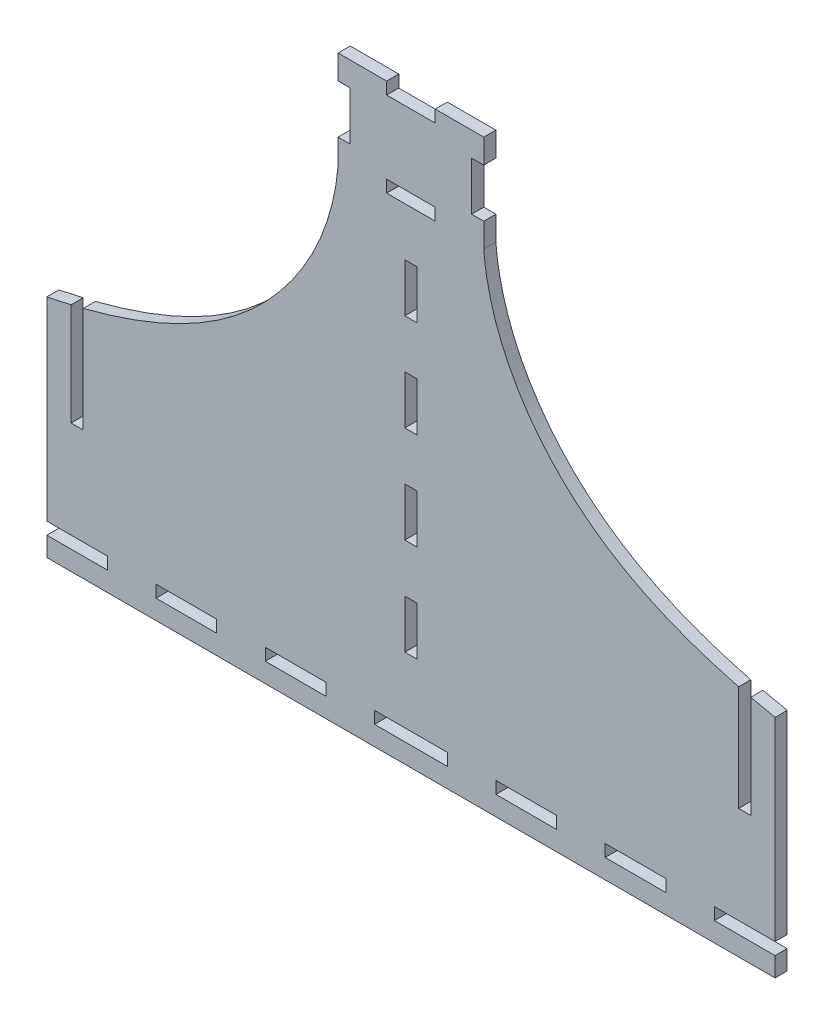
from build123d import *

# Parameters (mm, degrees)
SKETCH1_W           = 20
SKETCH1_H           = 5
SKETCH1_W_2         = 5
SKETCH1_H_2         = 20
SKETCH1_W_3         = 25
SKETCH1_W_4         = 30
BOSS_EXTRUDE1_DEPTH = 5


with BuildPart() as part:
    # Sketch1 → Boss-Extrude1 (new body)
    with BuildSketch(Plane.XY):
        with BuildLine():
            Line((-39.784412909, 125.453201578), (-39.784412909, 135.453201578))
            Line((-39.784412909, 135.453201578), (-44.784412909, 135.453201578))
            Line((-44.784412909, 135.453201578), (-44.784412909, 155.453201578))
            Line((-44.784412909, 155.453201578), (-39.784412909, 155.453201578))
            Line((-39.784412909, 155.453201578), (-39.784412909, 165.453201578))
            Line((-39.784412909, 165.453201578), (-59.784412909, 165.453201578))
            Line((-59.784412909, 165.453201578), (-59.784412909, 160.453201578))
            Line((-59.784412909, 160.453201578), (-79.784412909, 160.453201578))
            Line((-79.784412909, 160.453201578), (-79.784412909, 165.453201578))
            Line((-79.784412909, 165.453201578), (-99.784412909, 165.453201578))
            Line((-99.784412909, 165.453201578), (-99.784412909, 155.453201578))
            Line((-99.784412909, 155.453201578), (-94.784412909, 155.453201578))
            Line((-94.784412909, 155.453201578), (-94.784412909, 135.453201578))
            Line((-94.784412909, 135.453201578), (-99.784412909, 135.453201578))
            Line((-99.784412909, 135.453201578), (-99.784412909, 125.453201578))
            add(Edge.make_bspline(
                [(-204.784412909, 21.843580993), (-197.506230119, 23.701939803), (-175.474625692, 30.348491442), (-128.147146094, 54.275433129), (-102.183870773, 95.209842597), (-99.784412909, 125.453201578)],
                knots=[0.089716065, 0.089716065, 0.089716065, 0.089716065, 0.220283612, 0.4864068, 1, 1, 1, 1], degree=3))
            Line((-204.784412909, 21.843580993), (-204.784412909, -21.546798422))
            Line((-204.784412909, -21.546798422), (-209.784412909, -21.546798422))
            Line((-209.784412909, -21.546798422), (-209.784412909, 20.618388045))
            add(Edge.make_bspline(
                [(-219.784412909, 18.453201578), (-214.791132261, 19.441715958), (-209.784412909, 20.618388045)],
                knots=[0, 0, 0, 0.0598328, 0.0598328, 0.0598328], degree=2))
            Line((-219.784412909, 18.453201578), (-219.784412909, -61.546798422))
            Line((-219.784412909, -61.546798422), (-194.784412909, -61.546798422))
            Line((-194.784412909, -61.546798422), (-194.784412909, -66.546798422))
            Line((-194.784412909, -66.546798422), (-219.784412909, -66.546798422))
            Line((-219.784412909, -66.546798422), (-219.784412909, -74.546798422))
            Line((-219.784412909, -74.546798422), (80.215587091, -74.546798422))
            Line((80.215587091, -74.546798422), (80.215587091, -66.546798422))
            Line((80.215587091, -66.546798422), (55.215587091, -66.546798422))
            Line((55.215587091, -66.546798422), (55.215587091, -61.546798422))
            Line((55.215587091, -61.546798422), (80.215587091, -61.546798422))
            Line((80.215587091, -61.546798422), (80.215587091, 18.453201578))
            add(Edge.make_bspline(
                [(80.215587091, 18.453201578), (75.222306443, 19.441715958), (70.215587091, 20.618388045)],
                knots=[0, 0, 0, 0.0598328, 0.0598328, 0.0598328], degree=2))
            Line((70.215587091, 20.618388045), (70.215587091, -21.546798422))
            Line((70.215587091, -21.546798422), (65.215587091, -21.546798422))
            Line((65.215587091, -21.546798422), (65.215587091, 21.843580993))
            add(Edge.make_bspline(
                [(65.215587091, 21.843580993), (57.937404301, 23.701939803), (35.905799874, 30.348491442), (-11.421679724, 54.275433129), (-37.384955046, 95.209842597), (-39.784412909, 125.453201578)],
                knots=[0.089716065, 0.089716065, 0.089716065, 0.089716065, 0.220283612, 0.4864068, 1, 1, 1, 1], degree=3))
        make_face()
        with Locations((-69.784412909, 127.953201578)):
            Rectangle(SKETCH1_W, SKETCH1_H, mode=Mode.SUBTRACT)
        with Locations((-69.784412909, 55.453201578)):
            Rectangle(SKETCH1_W_2, SKETCH1_H_2, mode=Mode.SUBTRACT)
        with Locations((-69.784412909, 95.453201578)):
            Rectangle(SKETCH1_W_2, SKETCH1_H_2, mode=Mode.SUBTRACT)
        with Locations((22.715587091, -64.046798422)):
            Rectangle(SKETCH1_W_3, SKETCH1_H, mode=Mode.SUBTRACT)
        with Locations((-22.284412909, -64.046798422)):
            Rectangle(SKETCH1_W_3, SKETCH1_H, mode=Mode.SUBTRACT)
        with Locations((-69.784412909, -64.046798422)):
            Rectangle(SKETCH1_W_4, SKETCH1_H, mode=Mode.SUBTRACT)
        with Locations((-117.284412909, -64.046798422)):
            Rectangle(SKETCH1_W_3, SKETCH1_H, mode=Mode.SUBTRACT)
        with Locations((-162.284412909, -64.046798422)):
            Rectangle(SKETCH1_W_3, SKETCH1_H, mode=Mode.SUBTRACT)
        with Locations((-69.784412909, 15.453201578)):
            Rectangle(SKETCH1_W_2, SKETCH1_H_2, mode=Mode.SUBTRACT)
        with Locations((-69.784412909, -24.546798422)):
            Rectangle(SKETCH1_W_2, SKETCH1_H_2, mode=Mode.SUBTRACT)
    extrude(amount=BOSS_EXTRUDE1_DEPTH)


solid = part.part
